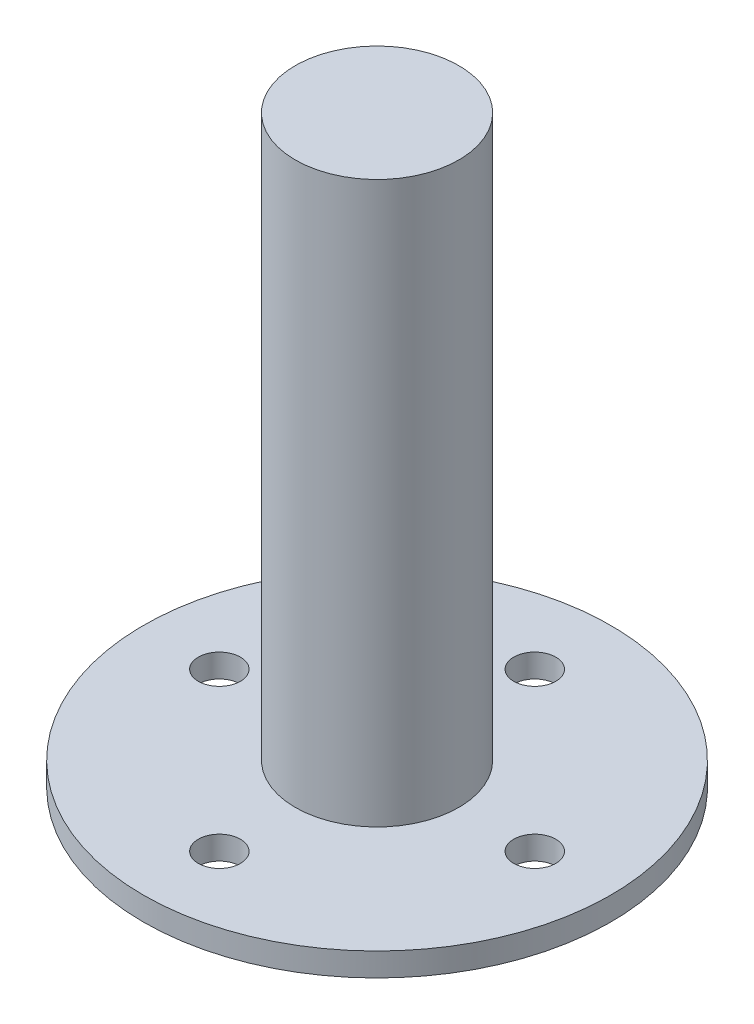
from build123d import *

# Parameters (mm, degrees)
SZKIC1_R                    = 50
DODANIE_WYCI_GNI_CIE1_DEPTH = 5
SZKIC2_R                    = 17.5
DODANIE_WYCI_GNI_CIE2_DEPTH = 120
OTW_R_POD_RUB_M81_D         = 9


with BuildPart() as part:
    # Szkic1 → Dodanie-wyciągnięcie1 (new body)
    with BuildSketch(Plane(origin=(0, 0, 0), x_dir=(1, 0, 0), z_dir=(0, 1, 0))):
        with Locations(Location((0, 0, 0), (0, 0, 270))):
            Circle(SZKIC1_R)
    extrude(amount=DODANIE_WYCI_GNI_CIE1_DEPTH)

    # Szkic2 → Dodanie-wyciągnięcie2 (add)
    with BuildSketch(Plane(origin=(0, 5, 0), x_dir=(1, 0, 0), z_dir=(0, 1, 0))):
        with Locations(Location((0, 0, 0), (0, 0, 270))):
            Circle(SZKIC2_R)
    extrude(amount=DODANIE_WYCI_GNI_CIE2_DEPTH)

    # Otwór pod śrubę M81 (through all)
    with Locations(Plane(origin=(0, 5, 0), x_dir=(1, 0, 0), z_dir=(0, 1, 0))):
        with Locations((-33.75, 0), (0, 33.75), (0, -33.75), (33.75, 0)):
            Hole(OTW_R_POD_RUB_M81_D / 2)


solid = part.part
